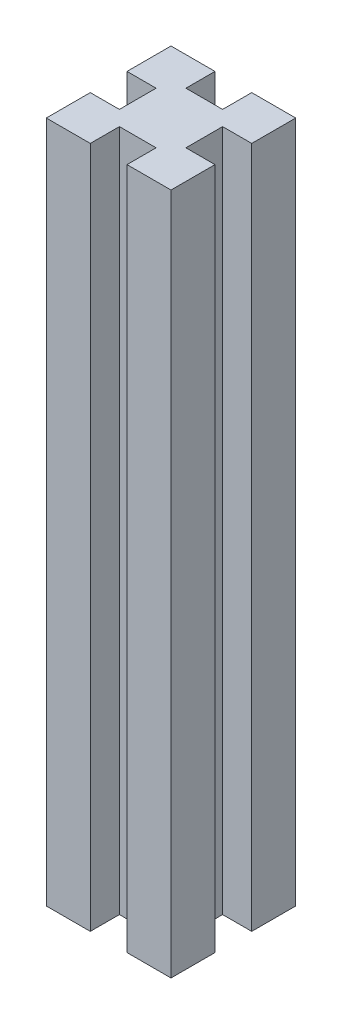
from build123d import *

# Parameters (mm, degrees)
BOSS_EXTRUDE1_DEPTH = 152.4


with BuildPart() as part:
    # Sketch1 → Boss-Extrude1 (new body)
    with BuildSketch(Plane(origin=(0, 0, 0), x_dir=(1, 0, 0), z_dir=(0, 1, 0))):
        Polygon((7.425, 4.1), (13.925, 4.1), (13.925, 13.925), (4.1, 13.925), (4.1, 7.425), (-4.1, 7.425), (-4.1, 13.925), (-13.925, 13.925), (-13.925, 4.1), (-7.425, 4.1), (-7.425, -4.1), (-13.925, -4.1), (-13.925, -13.925), (-4.1, -13.925), (-4.1, -7.425), (4.1, -7.425), (4.1, -13.925), (13.925, -13.925), (13.925, -4.1), (7.425, -4.1), align=None)
    extrude(amount=BOSS_EXTRUDE1_DEPTH)


solid = part.part
